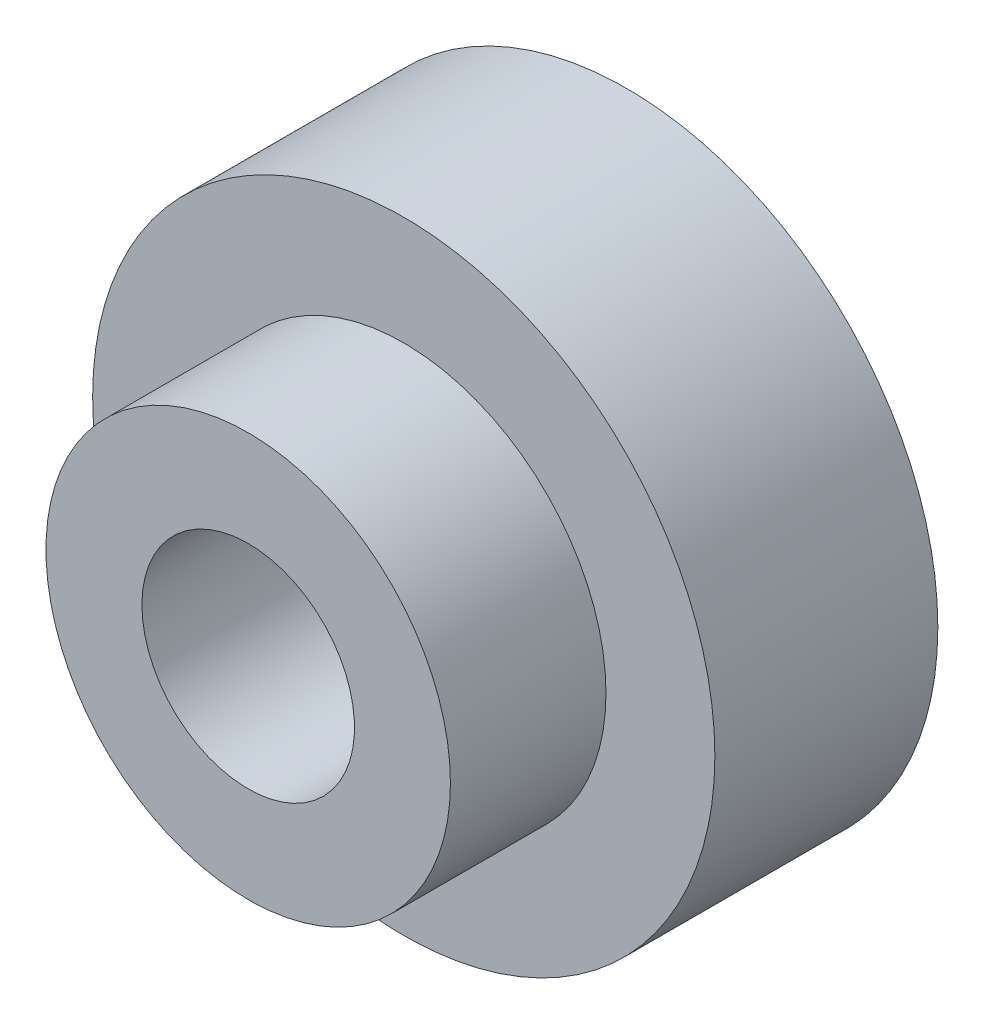
from build123d import *

# Parameters (mm, degrees)
SKETCH1_R           = 6
SKETCH1_R_2         = 2.05
BOSS_EXTRUDE1_DEPTH = 4.3
SKETCH2_R           = 3.9
SKETCH2_R_2         = 2.05
BOSS_EXTRUDE2_DEPTH = 3


with BuildPart() as part:
    # Sketch1 → Boss-Extrude1 (new body)
    with BuildSketch(Plane.XY):
        with Locations(Location((0, 0, 0), (0, 0, 180))):
            Circle(SKETCH1_R)
        with Locations(Location((0, 0, 0), (0, 0, 180))):
            Circle(SKETCH1_R_2, mode=Mode.SUBTRACT)
    extrude(amount=BOSS_EXTRUDE1_DEPTH)

    # Sketch2 → Boss-Extrude2 (add)
    with BuildSketch(Plane.XY.offset(4.3)):
        Circle(SKETCH2_R)
        with Locations(Location((0, 0, 0), (0, 0, 180))):
            Circle(SKETCH2_R_2, mode=Mode.SUBTRACT)
    extrude(amount=BOSS_EXTRUDE2_DEPTH)


solid = part.part
